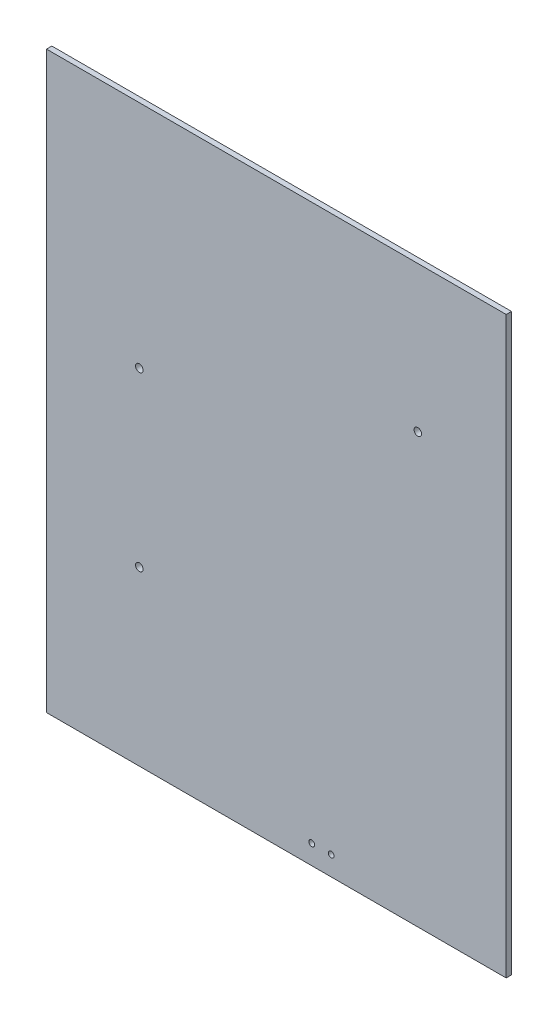
from build123d import *

# Parameters (mm, degrees)
ESQUISSE1_W             = 520
ESQUISSE1_H             = 650
BASE_EXTRUSION_DEPTH    = 6
ENL_V_MAT_EXTRU_1_REACH = 834.428
ESQUISSE2_R             = 4.25
ENL_V_MAT_EXTRU_2_REACH = 834.428
ESQUISSE3_R             = 3.25


with BuildPart() as part:
    # Esquisse1 → Base-Extrusion (new body)
    with BuildSketch(Plane.XY):
        with Locations((260, 325)):
            Rectangle(ESQUISSE1_W, ESQUISSE1_H)
    extrude(amount=BASE_EXTRUSION_DEPTH)

    # Esquisse2 → Enlèv. mat.-Extru.1 (cut, up to next)
    with BuildSketch(Plane.XY.offset(6), mode=Mode.PRIVATE) as enl_v_mat_extru_1_sk1:
        with Locations((420, 485)):
            Circle(ESQUISSE2_R)
    enl_v_mat_extru_1_tool1 = extrude(enl_v_mat_extru_1_sk1.sketch, amount=-ENL_V_MAT_EXTRU_1_REACH, mode=Mode.PRIVATE) & part.part
    # Esquisse2 → Enlèv. mat.-Extru.1 (cut, up to next)
    with BuildSketch(Plane.XY.offset(6), mode=Mode.PRIVATE) as enl_v_mat_extru_1_sk2:
        with Locations((105, 390)):
            Circle(ESQUISSE2_R)
    enl_v_mat_extru_1_tool2 = extrude(enl_v_mat_extru_1_sk2.sketch, amount=-ENL_V_MAT_EXTRU_1_REACH, mode=Mode.PRIVATE) & part.part
    # Esquisse2 → Enlèv. mat.-Extru.1 (cut, up to next)
    with BuildSketch(Plane.XY.offset(6), mode=Mode.PRIVATE) as enl_v_mat_extru_1_sk3:
        with Locations((105, 195)):
            Circle(ESQUISSE2_R)
    enl_v_mat_extru_1_tool3 = extrude(enl_v_mat_extru_1_sk3.sketch, amount=-ENL_V_MAT_EXTRU_1_REACH, mode=Mode.PRIVATE) & part.part
    add(enl_v_mat_extru_1_tool1.solids().sort_by_distance((420, 485, 6))[0], mode=Mode.SUBTRACT)
    add(enl_v_mat_extru_1_tool2.solids().sort_by_distance((105, 390, 6))[0], mode=Mode.SUBTRACT)
    add(enl_v_mat_extru_1_tool3.solids().sort_by_distance((105, 195, 6))[0], mode=Mode.SUBTRACT)

    # Esquisse3 → Enlèv. mat.-Extru.2 (cut, up to next)
    with BuildSketch(Plane.XY.offset(6), mode=Mode.PRIVATE) as enl_v_mat_extru_2_sk1:
        with Locations((300, 22)):
            Circle(ESQUISSE3_R)
    enl_v_mat_extru_2_tool1 = extrude(enl_v_mat_extru_2_sk1.sketch, amount=-ENL_V_MAT_EXTRU_2_REACH, mode=Mode.PRIVATE) & part.part
    # Esquisse3 → Enlèv. mat.-Extru.2 (cut, up to next)
    with BuildSketch(Plane.XY.offset(6), mode=Mode.PRIVATE) as enl_v_mat_extru_2_sk2:
        with Locations((322, 22)):
            Circle(ESQUISSE3_R)
    enl_v_mat_extru_2_tool2 = extrude(enl_v_mat_extru_2_sk2.sketch, amount=-ENL_V_MAT_EXTRU_2_REACH, mode=Mode.PRIVATE) & part.part
    add(enl_v_mat_extru_2_tool1.solids().sort_by_distance((300, 22, 6))[0], mode=Mode.SUBTRACT)
    add(enl_v_mat_extru_2_tool2.solids().sort_by_distance((322, 22, 6))[0], mode=Mode.SUBTRACT)


solid = part.part
